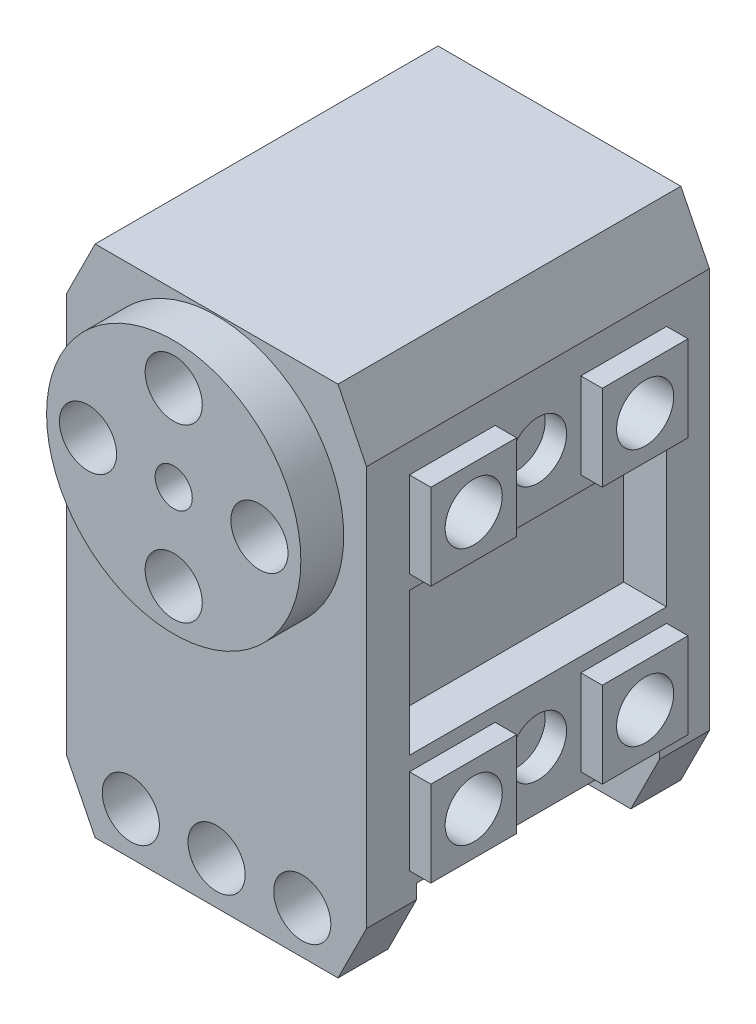
from build123d import *
from OCP.BRepFilletAPI import BRepFilletAPI_MakeChamfer

# Parameters (mm, degrees)
SKETCH1_W               = 21
SKETCH1_H               = 36
SKETCH1_R               = 8.9
BOSS_EXTRUDE1_DEPTH     = 24
SKETCH1_2_R             = 8.9
BOSS_EXTRUDE2_DEPTH     = 27
SKETCH2_R               = 2
SKETCH2_R_2             = 1.3
CUT_EXTRUDE1_DEPTH      = 3
CHAMFER1_SIZE           = 4
CHAMFER1_SIZE2          = 2
CHAMFER2_SIZE           = 2
CHAMFER2_SIZE2          = 4
CUT_EXTRUDE2_DEPTH      = 32.784430151
CUT_EXTRUDE2_DEPTH_BACK = 32.784430151
SKETCH4_R               = 2
CUT_EXTRUDE3_DEPTH      = 39.65229618
CUT_EXTRUDE3_DEPTH_BACK = 39.65229618
SKETCH5_W               = 17
SKETCH5_H               = 12.551801511
SKETCH7_W               = 6
SKETCH7_H               = 6
BOSS_EXTRUDE3_DEPTH     = 1.5
BOSS_EXTRUDE4_START     = -21
SKETCH7_2_W             = 6
SKETCH7_2_H             = 6
BOSS_EXTRUDE4_DEPTH     = 1.5
CUT_EXTRUDE6_START      = 1.5
SKETCH6_R               = 2
CUT_EXTRUDE6_DEPTH      = 3
CUT_EXTRUDE7_START      = -19.5
SKETCH6_3_R             = 2
CUT_EXTRUDE7_DEPTH      = 3
SKETCH8_W               = 18
SKETCH8_H               = 10
CUT_EXTRUDE8_DEPTH      = 3
CUT_EXTRUDE9_START      = -21
SKETCH8_2_W             = 18
SKETCH8_2_H             = 10
CUT_EXTRUDE9_DEPTH      = 3


with BuildPart() as part:
    # Sketch1 → Boss-Extrude1 (new body)
    with BuildSketch(Plane.XY):
        Rectangle(SKETCH1_W, SKETCH1_H)
        with Locations((0, 9)):
            Circle(SKETCH1_R, mode=Mode.SUBTRACT)
    extrude(amount=BOSS_EXTRUDE1_DEPTH)

    # Sketch1<2> → Boss-Extrude2 (add)
    with BuildSketch(Plane.XY):
        with Locations((0, 9)):
            Circle(SKETCH1_2_R)
    extrude(amount=BOSS_EXTRUDE2_DEPTH)

    # Sketch2 → Cut-Extrude1 (cut)
    with BuildSketch(Plane.XY.offset(27)):
        with Locations((0, 15)):
            Circle(SKETCH2_R)
        with Locations((6, 9)):
            Circle(SKETCH2_R)
        with Locations((0, 3)):
            Circle(SKETCH2_R)
        with Locations((-6, 9)):
            Circle(SKETCH2_R)
        with Locations((0, 9)):
            Circle(SKETCH2_R_2)
    extrude(amount=-CUT_EXTRUDE1_DEPTH, mode=Mode.SUBTRACT)

    # Chamfer1: one chamfer whose edges measure the first distance from different faces: ONE call of the kernel's chamfer builder (chamfer() names one face for all edges)
    chamfer1_edges_1 = [part.edges().sort_by_distance(p)[0] for p in [
        (-10.5, -18, 12),
    ]]
    chamfer1_side_1 = [part.faces().sort_by_distance(p)[0] for p in [
        (-10.5, 0, 12),
    ]]
    chamfer1_edges_2 = [part.edges().sort_by_distance(p)[0] for p in [
        (10.5, 18, 12),
    ]]
    chamfer1_side_2 = [part.faces().sort_by_distance(p)[0] for p in [
        (10.5, 0, 12),
    ]]
    chamfer1 = BRepFilletAPI_MakeChamfer(part.part.solid().wrapped)
    for e in chamfer1_edges_1:
        chamfer1.Add(CHAMFER1_SIZE, CHAMFER1_SIZE2, e.wrapped, chamfer1_side_1[0].wrapped)  # the first distance lies on this face
    for e in chamfer1_edges_2:
        chamfer1.Add(CHAMFER1_SIZE, CHAMFER1_SIZE2, e.wrapped, chamfer1_side_2[0].wrapped)  # the first distance lies on this face
    add(Compound.cast(chamfer1.Shape()), mode=Mode.REPLACE)

    # Chamfer2: one chamfer whose edges measure the first distance from different faces: ONE call of the kernel's chamfer builder (chamfer() names one face for all edges)
    chamfer2_edges_1 = [part.edges().sort_by_distance(p)[0] for p in [
        (10.5, -18, 12),
    ]]
    chamfer2_side_1 = [part.faces().sort_by_distance(p)[0] for p in [
        (1, -18, 12),
    ]]
    chamfer2_edges_2 = [part.edges().sort_by_distance(p)[0] for p in [
        (-10.5, 18, 12),
    ]]
    chamfer2_side_2 = [part.faces().sort_by_distance(p)[0] for p in [
        (-1, 18, 12),
    ]]
    chamfer2 = BRepFilletAPI_MakeChamfer(part.part.solid().wrapped)
    for e in chamfer2_edges_1:
        chamfer2.Add(CHAMFER2_SIZE, CHAMFER2_SIZE2, e.wrapped, chamfer2_side_1[0].wrapped)  # the first distance lies on this face
    for e in chamfer2_edges_2:
        chamfer2.Add(CHAMFER2_SIZE, CHAMFER2_SIZE2, e.wrapped, chamfer2_side_2[0].wrapped)  # the first distance lies on this face
    add(Compound.cast(chamfer2.Shape()), mode=Mode.REPLACE)

    # Sketch4 → Cut-Extrude2 (cut, two sides: drawn at the far end of the back side and taken through both)
    with BuildSketch(Plane.XY.offset(24).offset(-CUT_EXTRUDE2_DEPTH_BACK)):
        with Locations((0, -15)):
            Circle(SKETCH4_R)
        with Locations((-6, -15)):
            Circle(SKETCH4_R)
        with Locations((6, -15)):
            Circle(SKETCH4_R)
    extrude(amount=CUT_EXTRUDE2_DEPTH + CUT_EXTRUDE2_DEPTH_BACK, mode=Mode.SUBTRACT)

    # Sketch5 → Cut-Extrude3 (cut, two sides: drawn at the far end of the back side and taken through both)
    with BuildSketch(Plane.ZY.offset(10.5).offset(-CUT_EXTRUDE3_DEPTH_BACK)):
        with Locations((12, -19.275900756)):
            Rectangle(SKETCH5_W, SKETCH5_H)
    extrude(amount=CUT_EXTRUDE3_DEPTH + CUT_EXTRUDE3_DEPTH_BACK, mode=Mode.SUBTRACT)

    # Sketch7 → Boss-Extrude3 (add)
    with BuildSketch(Plane(origin=(10.5, 0, 0), x_dir=(0, 0, -1), z_dir=(1, 0, 0))):
        with Locations((-18, 9)):
            Rectangle(SKETCH7_W, SKETCH7_H)
        with Locations((-6, 9)):
            Rectangle(SKETCH7_W, SKETCH7_H)
        with Locations((-6, -9)):
            Rectangle(SKETCH7_W, SKETCH7_H)
        with Locations((-18, -9)):
            Rectangle(SKETCH7_W, SKETCH7_H)
    extrude(amount=BOSS_EXTRUDE3_DEPTH)

    # Sketch7<2> → Boss-Extrude4 (add)
    with BuildSketch(Plane(origin=(10.5, 0, 0), x_dir=(0, 0, -1), z_dir=(1, 0, 0)).offset(BOSS_EXTRUDE4_START)):
        with Locations((-18, 9)):
            Rectangle(SKETCH7_2_W, SKETCH7_2_H)
        with Locations((-6, 9)):
            Rectangle(SKETCH7_2_W, SKETCH7_2_H)
        with Locations((-6, -9)):
            Rectangle(SKETCH7_2_W, SKETCH7_2_H)
        with Locations((-18, -9)):
            Rectangle(SKETCH7_2_W, SKETCH7_2_H)
    extrude(amount=-BOSS_EXTRUDE4_DEPTH)

    # Sketch6 → Cut-Extrude6 (cut)
    with BuildSketch(Plane(origin=(10.5, 0, 0), x_dir=(0, 0, -1), z_dir=(1, 0, 0)).offset(CUT_EXTRUDE6_START)):
        with Locations((-12, 9)):
            Circle(SKETCH6_R)
        with Locations((-6, 9)):
            Circle(SKETCH6_R)
        with Locations((-18, 9)):
            Circle(SKETCH6_R)
        with Locations((-12, -9)):
            Circle(SKETCH6_R)
        with Locations((-6, -9)):
            Circle(SKETCH6_R)
        with Locations((-18, -9)):
            Circle(SKETCH6_R)
    extrude(amount=-CUT_EXTRUDE6_DEPTH, mode=Mode.SUBTRACT)

    # Sketch6<3> → Cut-Extrude7 (cut)
    with BuildSketch(Plane(origin=(10.5, 0, 0), x_dir=(0, 0, -1), z_dir=(1, 0, 0)).offset(CUT_EXTRUDE7_START)):
        with Locations((-12, 9)):
            Circle(SKETCH6_3_R)
        with Locations((-6, 9)):
            Circle(SKETCH6_3_R)
        with Locations((-18, 9)):
            Circle(SKETCH6_3_R)
        with Locations((-12, -9)):
            Circle(SKETCH6_3_R)
        with Locations((-6, -9)):
            Circle(SKETCH6_3_R)
        with Locations((-18, -9)):
            Circle(SKETCH6_3_R)
    extrude(amount=-CUT_EXTRUDE7_DEPTH, mode=Mode.SUBTRACT)

    # Sketch8 → Cut-Extrude8 (cut)
    with BuildSketch(Plane(origin=(10.5, 0, 0), x_dir=(0, 0, -1), z_dir=(1, 0, 0))):
        with Locations((-12, 0)):
            Rectangle(SKETCH8_W, SKETCH8_H)
    extrude(amount=-CUT_EXTRUDE8_DEPTH, mode=Mode.SUBTRACT)

    # Sketch8<2> → Cut-Extrude9 (cut)
    with BuildSketch(Plane(origin=(10.5, 0, 0), x_dir=(0, 0, -1), z_dir=(1, 0, 0)).offset(CUT_EXTRUDE9_START)):
        with Locations((-12, 0)):
            Rectangle(SKETCH8_2_W, SKETCH8_2_H)
    extrude(amount=CUT_EXTRUDE9_DEPTH, mode=Mode.SUBTRACT)


solid = part.part
